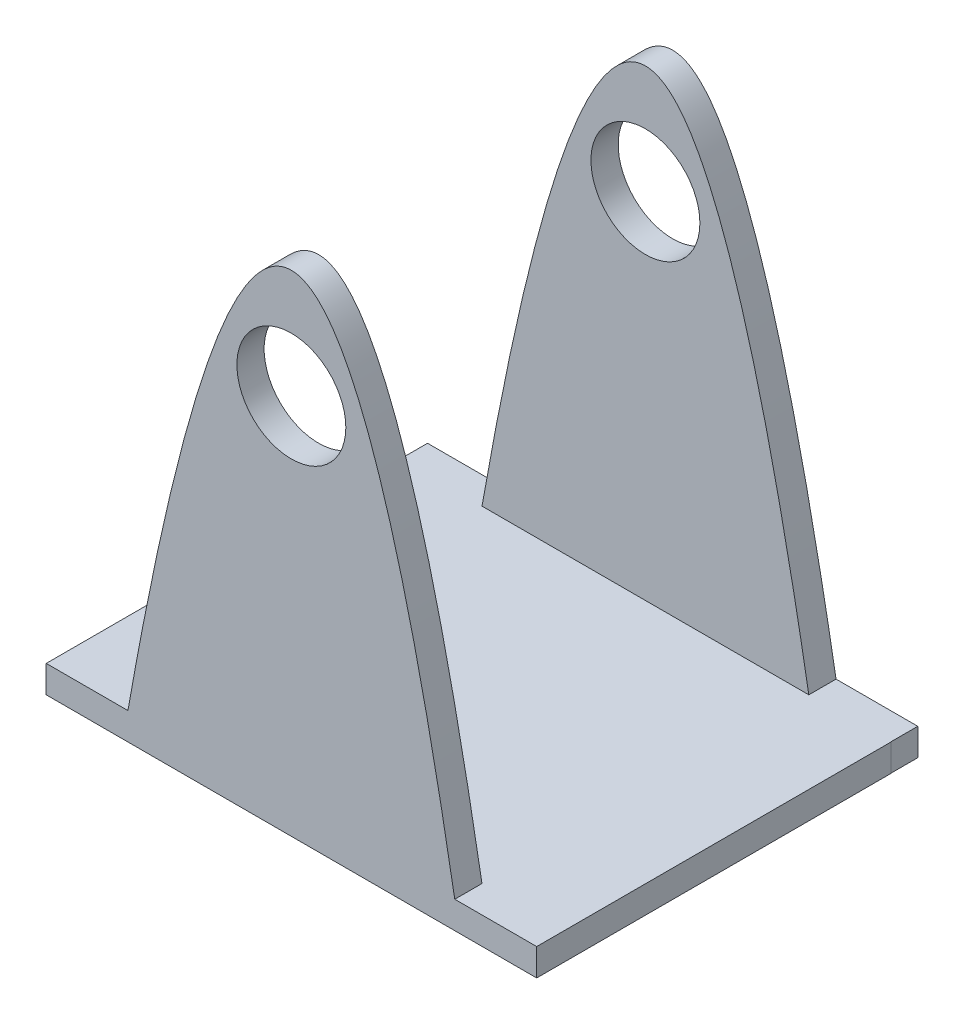
from build123d import *

# Parameters (mm, degrees)
SKETCH2_W           = 38.1
SKETCH2_H           = 12.7
BOSS_EXTRUDE1_DEPTH = 12.7
SKETCH4_W           = 228.702019181
SKETCH4_H           = 12.7
BOSS_EXTRUDE2_DEPTH = 152.4
SKETCH5_R           = 25.4
BOSS_EXTRUDE3_DEPTH = 12.7


with BuildPart() as part:
    # Sketch2 → Boss-Extrude1 (new body)
    with BuildSketch(Plane.XY):
        with BuildLine():
            add(Edge.make_bspline(
                [(-76.2, 6.35), (-38.1, 222.25), (0, 222.25)],
                knots=[0, 0, 0, 0.5, 0.5, 0.5], degree=2))
            Line((-76.2, 6.35), (-50.8, 6.35))
            Line((-50.8, 6.35), (0, 6.35))
            Line((0, 6.35), (0, 19.05))
            Line((0, 19.05), (0, 146.05))
            ThreePointArc((0, 146.05), (-25.4, 171.45), (0, 196.85))
            Line((0, 196.85), (0, 222.25))
        make_face()
        with BuildLine():
            add(Edge.make_bspline(
                [(-76.2, 6.35), (-38.1, 222.25), (0, 222.25)],
                knots=[0, 0, 0, 0.5, 0.5, 0.5], degree=2))
            Line((-76.2, 6.35), (-50.8, 6.35))
            Line((-50.8, 6.35), (0, 6.35))
            Line((0, 6.35), (0, 19.05))
            Line((0, 19.05), (0, 146.05))
            ThreePointArc((0, 146.05), (-25.4, 171.45), (0, 196.85))
            Line((0, 196.85), (0, 222.25))
        make_face()
        with BuildLine():
            add(Edge.make_bspline(
                [(0, 222.25), (38.1, 222.25), (76.2, 6.35)],
                knots=[0.5, 0.5, 0.5, 1, 1, 1], degree=2))
            Line((0, 222.25), (0, 196.85))
            ThreePointArc((0, 196.85), (17.960512242, 189.410512242), (25.4, 171.45))
            ThreePointArc((25.4, 171.45), (17.960512242, 153.489487758), (0, 146.05))
            Line((0, 146.05), (0, 19.05))
            Line((0, 19.05), (0, 6.35))
            Line((0, 6.35), (50.8, 6.35))
            Line((50.8, 6.35), (76.2, 6.35))
        make_face()
        with Locations((-95.25, 0)):
            Rectangle(SKETCH2_W, SKETCH2_H)
        Polygon((-50.8, 6.35), (-76.2, 6.35), (-76.2, -6.35), (76.2, -6.35), (76.2, 6.35), (50.8, 6.35), (0, 6.35), align=None)
        with Locations((95.25, 0)):
            Rectangle(SKETCH2_W, SKETCH2_H)
    extrude(amount=BOSS_EXTRUDE1_DEPTH)

    # Sketch4 → Boss-Extrude2 (add)
    with BuildSketch(Plane.XY.offset(12.7)):
        with Locations((0.051009591, 0)):
            Rectangle(SKETCH4_W, SKETCH4_H)
    extrude(amount=BOSS_EXTRUDE2_DEPTH)

    # Sketch5 → Boss-Extrude3 (add)
    with BuildSketch(Plane.XY.offset(165.1)):
        with BuildLine():
            Line((76.2, 6.35), (114.402019181, 6.35))
            Line((114.402019181, 6.35), (114.402019181, -6.35))
            Line((114.402019181, -6.35), (-114.3, -6.35))
            Line((-114.3, -6.35), (-114.3, 6.35))
            Line((-114.3, 6.35), (-76.2, 6.35))
            add(Edge.make_bspline(
                [(-76.2, 6.35), (0, 438.15), (76.2, 6.35)],
                knots=[0, 0, 0, 1, 1, 1], degree=2))
        make_face()
        with Locations((0, 171.45)):
            Circle(SKETCH5_R, mode=Mode.SUBTRACT)
    extrude(amount=BOSS_EXTRUDE3_DEPTH)


solid = part.part
